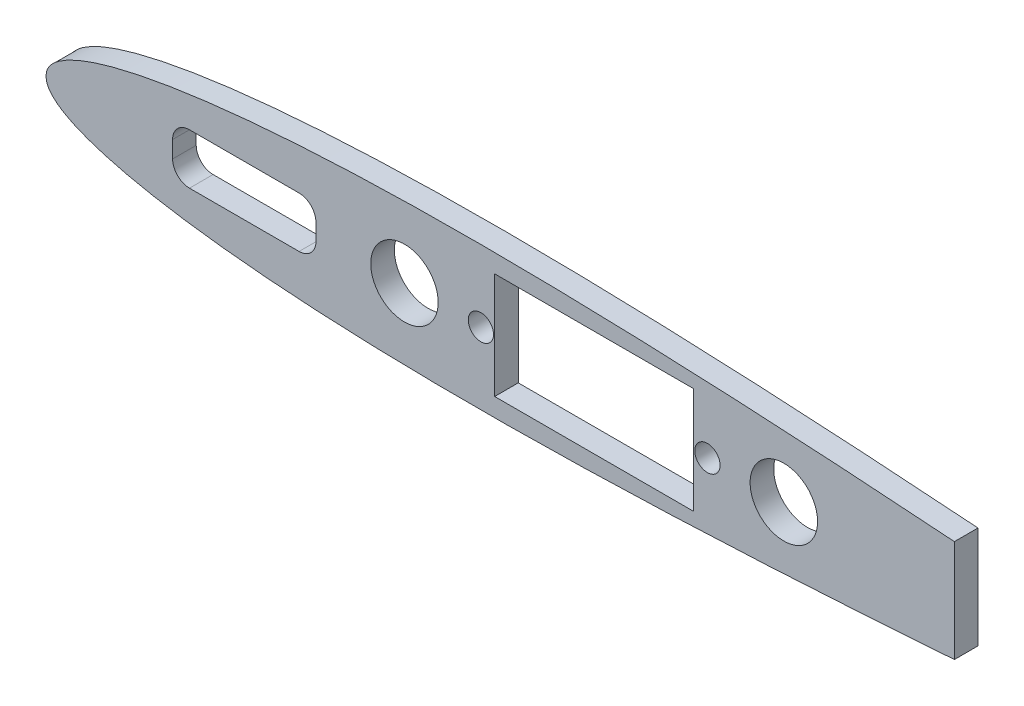
from build123d import *

# Parameters (mm, degrees)
SKETCH_1_R      = 4
SKETCH_1_W      = 23.6
SKETCH_1_H      = 12.6
SKETCH_1_R_2    = 1.5
EXTRUDE_1_DEPTH = 1.4


with BuildPart() as part:
    # Эскиз1 → Бобышка-Вытянуть1 (new, symmetric)
    with BuildSketch(Plane.XY):
        with BuildLine():
            Line((217.747634119, 2.35e-07), (217.747634119, 6.058113078))
            add(Edge.make_bspline(
                [(217.747634119, 6.058113078), (217.243808474, 6.094887376), (215.071311266, 6.252208631), (211.232977593, 6.52047435), (206.239642946, 6.848873), (201.268368917, 7.153826886), (196.331634567, 7.433105337), (191.441311474, 7.684604439), (186.608700127, 7.906218293), (181.844626933, 8.095958493), (177.159453511, 8.251957682), (172.563150272, 8.372486564), (168.065295924, 8.455953662), (163.675147454, 8.5010027), (159.401643404, 8.506522967), (155.253439756, 8.471528808), (151.238917925, 8.395506076), (147.366223919, 8.277985977), (143.643266298, 8.118975561), (140.077743555, 7.918678943), (136.677139412, 7.677604542), (133.448762895, 7.396480569), (130.399721686, 7.07642431), (127.536961089, 6.718650341), (124.867245825, 6.324666077), (122.397158974, 5.896120566), (120.133109351, 5.434797476), (118.081312133, 4.942567641), (116.247665798, 4.421392386), (114.63793972, 3.873060466), (113.256788366, 3.299309238), (112.109835923, 2.701306388), (111.196336341, 2.078555233), (110.530223642, 1.427069758), (110.085538218, 0.73423022), (110.027578176, 0.23672144), (110, 0)],
                knots=[0.362605011, 0.362605011, 0.362605011, 0.362605011, 0.371392651, 0.400495752, 0.429537687, 0.458441906, 0.487136113, 0.515551917, 0.543623846, 0.571289984, 0.59849081, 0.625169613, 0.651272029, 0.676746158, 0.701541791, 0.725611017, 0.748907835, 0.771387785, 0.793008139, 0.813728033, 0.833507815, 0.852309696, 0.87009731, 0.886835918, 0.902492782, 0.917037139, 0.930441054, 0.942679762, 0.953733567, 0.963589785, 0.972247019, 0.979722225, 0.986065145, 0.991385258, 0.995900989, 1, 1, 1, 1], degree=3))
            add(Edge.make_bspline(
                [(110, 0), (110.027578176, -0.23672144), (110.085538218, -0.73423022), (110.530223642, -1.427069758), (111.196336341, -2.078555233), (112.109835923, -2.701306388), (113.256788366, -3.299309238), (114.63793972, -3.873060466), (116.247665798, -4.421392386), (118.081312133, -4.942567641), (120.133109351, -5.434797476), (122.397158974, -5.896120566), (124.867245825, -6.324666077), (127.536961089, -6.718650341), (130.399721686, -7.07642431), (133.448762895, -7.396480569), (136.677139412, -7.677604542), (140.077743555, -7.918678943), (143.643266298, -8.118975561), (147.366223919, -8.277985977), (151.238917925, -8.395506076), (155.253439756, -8.471528808), (159.401643404, -8.506522967), (163.675147454, -8.5010027), (168.065295924, -8.455953662), (172.563150272, -8.372486564), (177.159453511, -8.251957682), (181.844626933, -8.095958493), (186.608700127, -7.906218293), (191.441311474, -7.684604439), (196.331634567, -7.433105337), (201.268368917, -7.153826886), (206.239642946, -6.848873), (211.232977593, -6.52047435), (215.071311266, -6.252208631), (217.243808474, -6.094887376), (217.747634119, -6.058113078)],
                knots=[0, 0, 0, 0, 0.004099011, 0.008614742, 0.013934855, 0.020277775, 0.027752981, 0.036410215, 0.046266433, 0.057320238, 0.069558946, 0.082962861, 0.097507218, 0.113164082, 0.12990269, 0.147690304, 0.166492185, 0.186271967, 0.206991861, 0.228612215, 0.251092165, 0.274388983, 0.298458209, 0.323253842, 0.348727971, 0.374830387, 0.40150919, 0.428710016, 0.456376154, 0.484448083, 0.512863887, 0.541558094, 0.570462313, 0.599504248, 0.628607349, 0.637394989, 0.637394989, 0.637394989, 0.637394989], degree=3))
            Line((217.747634119, -6.058113078), (217.747634119, 2.35e-07))
        make_face()
        with BuildLine():
            Line((140.01848428, -3), (127.01848428, -3))
            ThreePointArc((127.01848428, -3), (125.604270718, -2.414213562), (125.01848428, -1))
            Line((125.01848428, -1), (125.01848428, 1))
            ThreePointArc((125.01848428, 1), (125.604270718, 2.414213562), (127.01848428, 3))
            Line((127.01848428, 3), (140.01848428, 3))
            ThreePointArc((140.01848428, 3), (141.432697843, 2.414213562), (142.01848428, 1))
            Line((142.01848428, 1), (142.01848428, -1))
            ThreePointArc((142.01848428, -1), (141.432697843, -2.414213562), (140.01848428, -3))
        make_face(mode=Mode.SUBTRACT)
        with Locations((152.51848428, 0)):
            Circle(SKETCH_1_R, mode=Mode.SUBTRACT)
        with Locations((175.01848428, 0)):
            Rectangle(SKETCH_1_W, SKETCH_1_H, mode=Mode.SUBTRACT)
        with Locations((188.45348428, 0)):
            Circle(SKETCH_1_R_2, mode=Mode.SUBTRACT)
        with Locations((197.51848428, 0)):
            Circle(SKETCH_1_R, mode=Mode.SUBTRACT)
        with Locations((161.58348428, 0)):
            Circle(SKETCH_1_R_2, mode=Mode.SUBTRACT)
    extrude(amount=EXTRUDE_1_DEPTH, both=True)


solid = part.part
